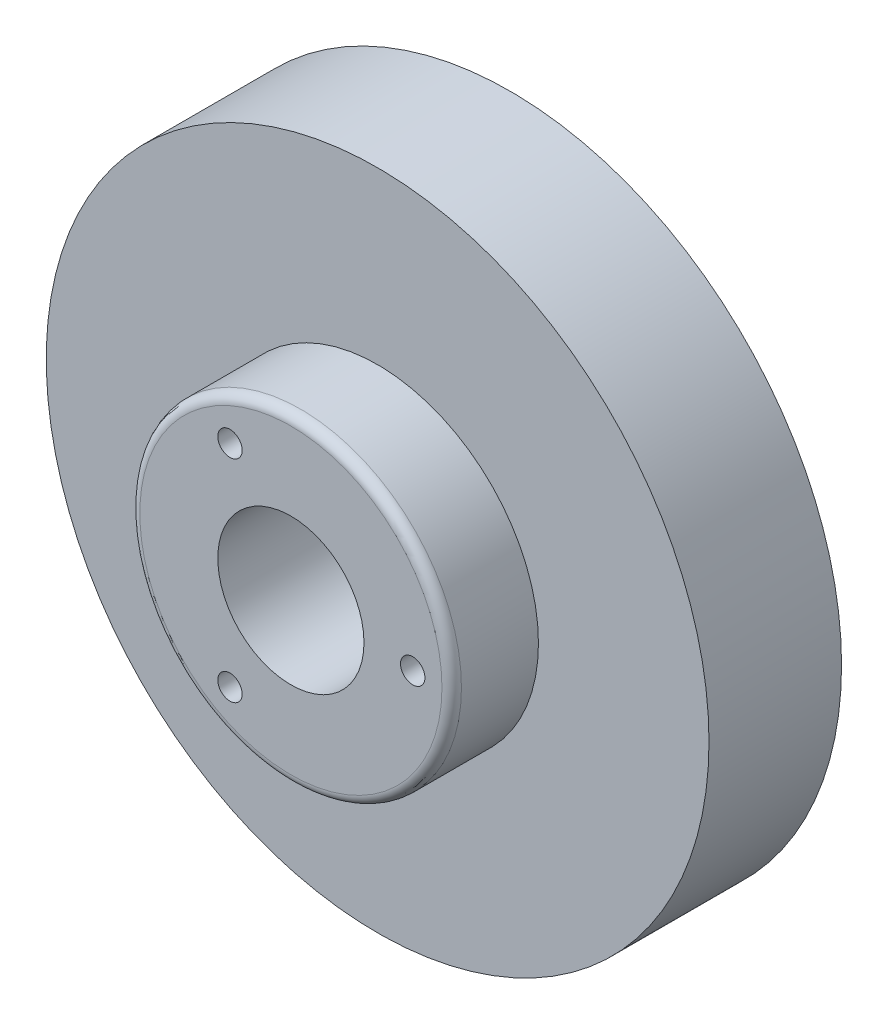
from build123d import *

# Parameters (mm, degrees)
SKETCH_1_R          = 34
EXTRUDE_1_DEPTH     = 13.6
SKETCH_2_R          = 16.5
EXTRUDE_2_DEPTH     = 8.9
FILLET_1_R          = 1
SKETCH_3_R          = 4
CUT_EXTRUDE_1_DEPTH = 54.087192429
SKETCH_4_R          = 7.5
CUT_EXTRUDE_2_DEPTH = 54.087192429
M3X0_52_D           = 2.5


with BuildPart() as part:
    # Эскиз1 → Бобышка-Вытянуть1 (new body)
    with BuildSketch(Plane.XY):
        Circle(SKETCH_1_R)
    extrude(amount=EXTRUDE_1_DEPTH)

    # Эскиз2 → Бобышка-Вытянуть2 (add)
    with BuildSketch(Plane.XY.offset(13.6)):
        Circle(SKETCH_2_R)
    extrude(amount=EXTRUDE_2_DEPTH)

    # Скругление1
    fillet_1_edges = [part.edges().sort_by_distance(p)[0] for p in [
        (-16.5, 0, 22.5),
    ]]
    fillet(fillet_1_edges, radius=FILLET_1_R)

    # Эскиз3 → Вырез-Вытянуть1 (cut, through all)
    with BuildSketch(Plane(origin=(0, 0, 0), x_dir=(-1, 0, 0), z_dir=(0, 0, -1))):
        Circle(SKETCH_3_R)
    extrude(amount=-CUT_EXTRUDE_1_DEPTH, mode=Mode.SUBTRACT)

    # Эскиз4 → Вырез-Вытянуть2 (cut, through all)
    with BuildSketch(Plane.XY.offset(22.5)):
        Circle(SKETCH_4_R)
    extrude(amount=-CUT_EXTRUDE_2_DEPTH, mode=Mode.SUBTRACT)

    # Отверстие обработанное метчиком M3x0.52 (through all)
    with Locations(Plane.XY.offset(22.5)):
        with Locations((-6.25, 10.825317547), (-6.25, -10.825317547), (12.5, 0)):
            Hole(M3X0_52_D / 2)


solid = part.part
